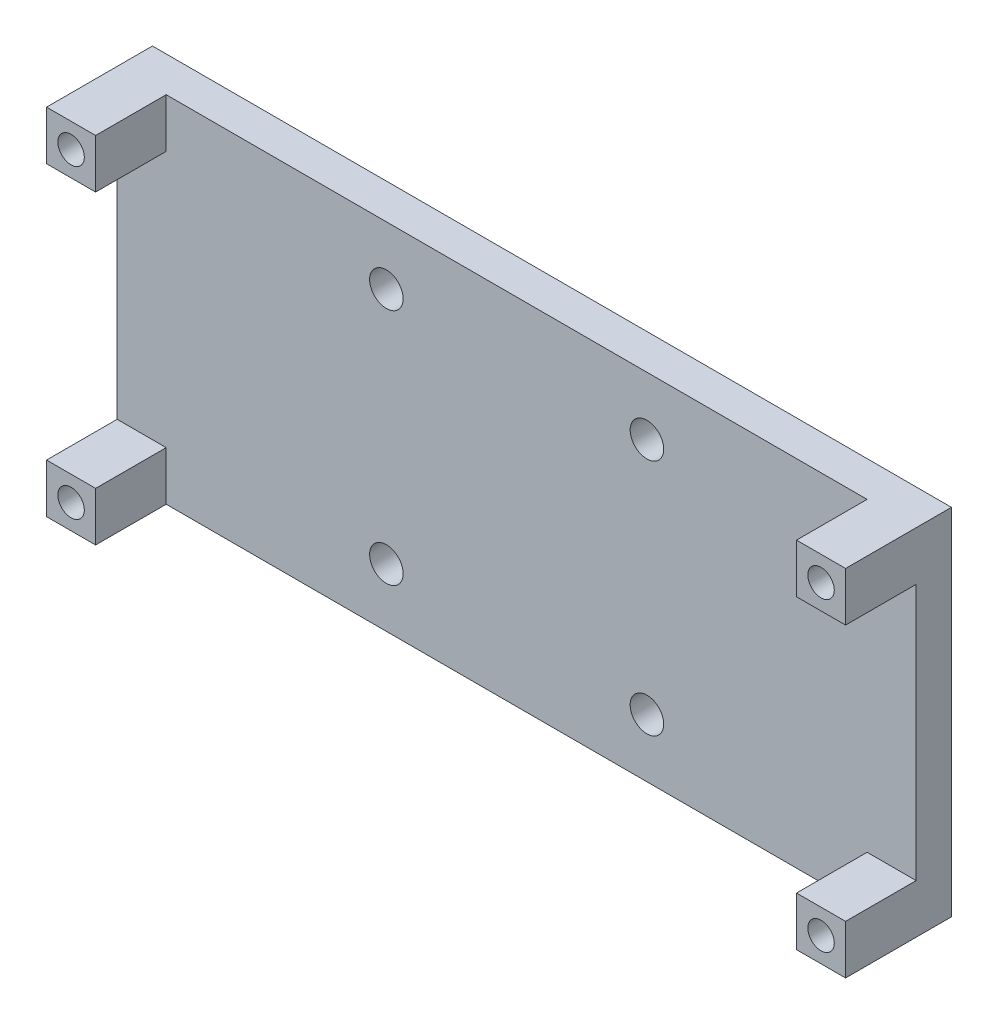
from build123d import *

# Parameters (mm, degrees)
SKETCH2_R           = 0.95
SKETCH2_R_2         = 0.75
BOSS_EXTRUDE1_DEPTH = 2
SKETCH4_W           = 2.78
SKETCH4_H           = 2.78
SKETCH4_R           = 0.75
BOSS_EXTRUDE2_DEPTH = 4


with BuildPart() as part:
    # Sketch2 → Boss-Extrude1 (new body)
    with BuildSketch(Plane.XY):
        Polygon((36.99, 25.1), (-8.29, 25.1), (-8.29, 5), (3.35, 5), (25.35, 5), (36.99, 5), align=None)
        with Locations((6.967324962, 8.304919624)):
            Circle(SKETCH2_R, mode=Mode.SUBTRACT)
        with Locations(Location((6.967324962, 21.795080376, 0), (0, 0, 180))):
            Circle(SKETCH2_R, mode=Mode.SUBTRACT)
        with Locations(Location((21.732675038, 8.304919624, 0), (0, 0, 180))):
            Circle(SKETCH2_R, mode=Mode.SUBTRACT)
        with Locations((21.732675038, 21.795080376)):
            Circle(SKETCH2_R, mode=Mode.SUBTRACT)
        with Locations((35.6, 23.71)):
            Circle(SKETCH2_R_2, mode=Mode.SUBTRACT)
        with Locations((35.6, 6.39)):
            Circle(SKETCH2_R_2, mode=Mode.SUBTRACT)
        with Locations((-6.9, 6.39)):
            Circle(SKETCH2_R_2, mode=Mode.SUBTRACT)
        with Locations((-6.9, 23.71)):
            Circle(SKETCH2_R_2, mode=Mode.SUBTRACT)
    extrude(amount=BOSS_EXTRUDE1_DEPTH)

    # Sketch4 → Boss-Extrude2 (add)
    # profile 1 of 4: a face of its own
    with BuildSketch(Plane.XY.offset(2)):
        with Locations((-6.9, 23.71)):
            Rectangle(SKETCH4_W, SKETCH4_H)
        with Locations((-6.9, 23.71)):
            Circle(SKETCH4_R, mode=Mode.SUBTRACT)
    # profile 2 of 4: a face of its own
    with BuildSketch(Plane.XY.offset(2)):
        with Locations((35.6, 23.71)):
            Rectangle(SKETCH4_W, SKETCH4_H)
        with Locations(Location((35.6, 23.71, 0), (0, 0, 180))):
            Circle(SKETCH4_R, mode=Mode.SUBTRACT)
    # profile 3 of 4: a face of its own
    with BuildSketch(Plane.XY.offset(2)):
        with Locations((35.6, 6.39)):
            Rectangle(SKETCH4_W, SKETCH4_H)
        with Locations((35.6, 6.39)):
            Circle(SKETCH4_R, mode=Mode.SUBTRACT)
    # profile 4 of 4: a face of its own
    with BuildSketch(Plane.XY.offset(2)):
        with Locations((-6.9, 6.39)):
            Rectangle(SKETCH4_W, SKETCH4_H)
        with Locations(Location((-6.9, 6.39, 0), (0, 0, 180))):
            Circle(SKETCH4_R, mode=Mode.SUBTRACT)
    extrude(amount=BOSS_EXTRUDE2_DEPTH)


solid = part.part
